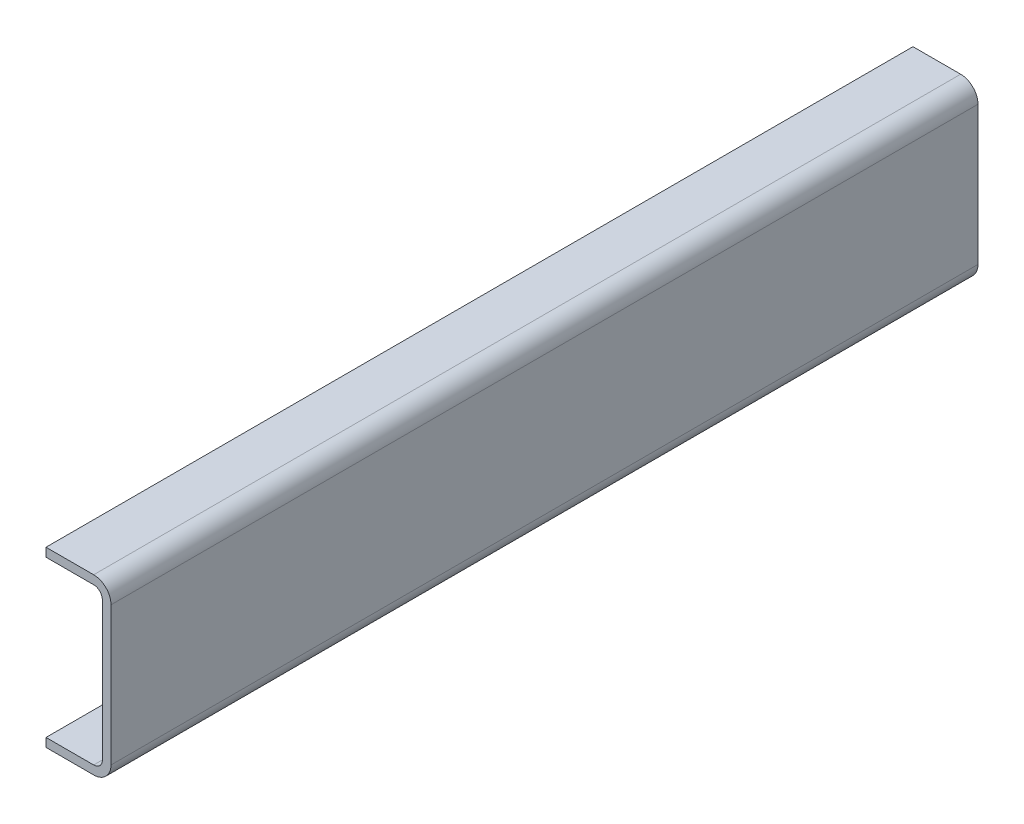
from build123d import *

# Parameters (mm, degrees)
BOSS_EXTRUDE1_DEPTH = 127


with BuildPart() as part:
    # Sketch1 → Boss-Extrude1 (new body)
    with BuildSketch(Plane.XY):
        with BuildLine():
            Line((0, 2.54), (0, 22.86))
            ThreePointArc((0, 22.86), (-0.743948776, 24.656051224), (-2.54, 25.4))
            Line((-2.54, 25.4), (-9.525, 25.4))
            Line((-9.525, 25.4), (-9.525, 24.13))
            Line((-9.525, 24.13), (-2.54, 24.13))
            ThreePointArc((-2.54, 24.13), (-1.641974388, 23.758025612), (-1.27, 22.86))
            Line((-1.27, 22.86), (-1.27, 2.54))
            ThreePointArc((-1.27, 2.54), (-1.641974388, 1.641974388), (-2.54, 1.27))
            Line((-2.54, 1.27), (-9.525, 1.27))
            Line((-9.525, 1.27), (-9.525, 0))
            Line((-9.525, 0), (-2.54, 0))
            ThreePointArc((-2.54, 0), (-0.743948776, 0.743948776), (0, 2.54))
        make_face()
    extrude(amount=BOSS_EXTRUDE1_DEPTH)


solid = part.part
